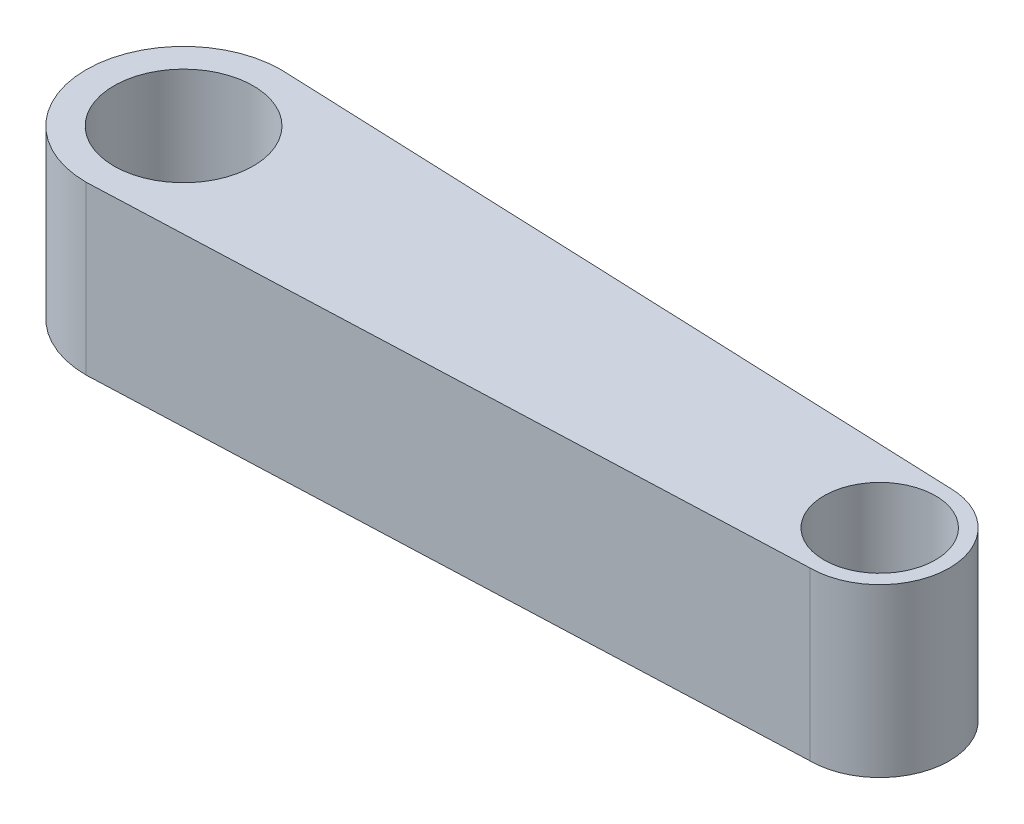
from build123d import *

# Parameters (mm, degrees)
BOSS_EXTRUDE1_DEPTH = 60
SKETCH3_R           = 25
SKETCH3_R_2         = 20
CUT_EXTRUDE1_DEPTH  = 50


with BuildPart() as part:
    # Sketch2 → Boss-Extrude1 (new body)
    with BuildSketch(Plane(origin=(0, 0, 0), x_dir=(1, 0, 0), z_dir=(0, 1, 0))):
        with BuildLine():
            Line((0, 35), (250, 25))
            ThreePointArc((250, 25), (275, 0), (250, -25))
            Line((250, -25), (0, -35))
            ThreePointArc((0, -35), (-35, 0), (0, 35))
        make_face()
    extrude(amount=BOSS_EXTRUDE1_DEPTH)

    # Sketch3 → Cut-Extrude1 (cut)
    with BuildSketch(Plane(origin=(0, 60, 0), x_dir=(1, 0, 0), z_dir=(0, 1, 0))):
        with Locations(Location((0, 0, 0), (0, 0, 270))):
            Circle(SKETCH3_R)
        with Locations(Location((250, 0, 0), (0, 0, 270))):
            Circle(SKETCH3_R_2)
    extrude(amount=-CUT_EXTRUDE1_DEPTH, mode=Mode.SUBTRACT)


solid = part.part
